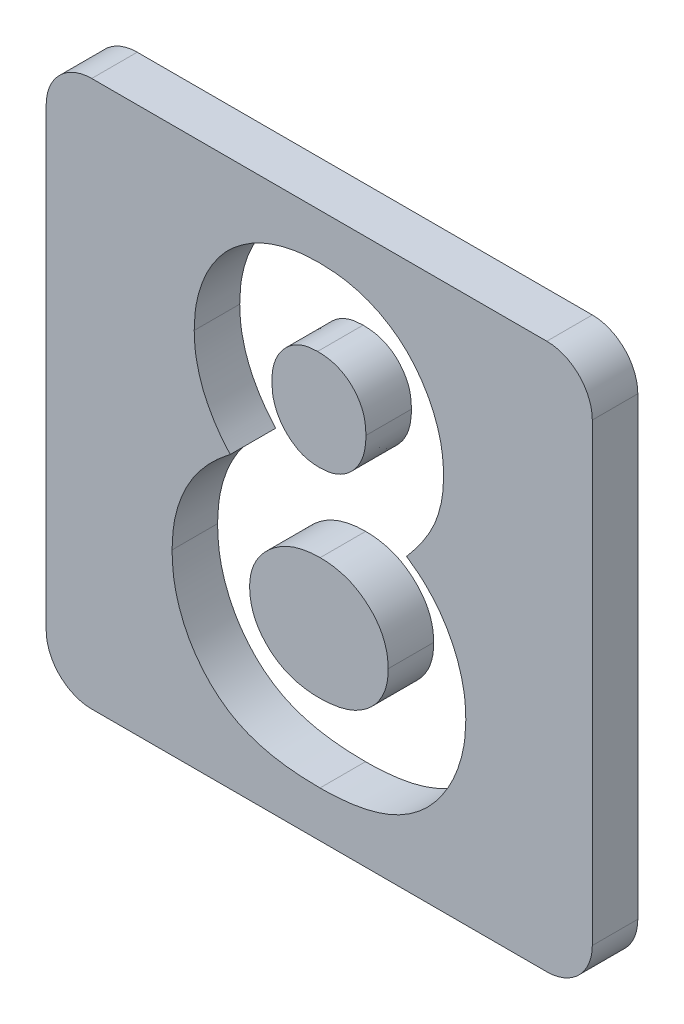
from build123d import *

# Parameters (mm, degrees)
BOSS_EXTRUDE1_DEPTH = 10
CUT_EXTRUDE7_DEPTH  = 10


with BuildPart() as part:
    # Sketch1 → Boss-Extrude1 (new body)
    with BuildSketch(Plane.XY):
        with BuildLine():
            Line((-50, 60), (50, 60))
            ThreePointArc((50, 60), (57.071067812, 57.071067812), (60, 50))
            Line((60, 50), (60, -50))
            ThreePointArc((60, -50), (57.071067812, -57.071067812), (50, -60))
            Line((50, -60), (-50, -60))
            ThreePointArc((-50, -60), (-57.071067812, -57.071067812), (-60, -50))
            Line((-60, -50), (-60, 50))
            ThreePointArc((-60, 50), (-57.071067812, 57.071067812), (-50, 60))
        make_face()
    extrude(amount=BOSS_EXTRUDE1_DEPTH)

    # Sketch2 → Cut-Extrude7 (cut)
    with BuildSketch(Plane.XY.offset(10)):
        with BuildLine():
            add(Edge.make_bspline(
                [(19.188301282, 3.653846154), (20.184495938, 2.942038158), (22.156373381, 1.53307845), (24.760502173, -0.991125553), (27.003564951, -3.806904393), (28.862007101, -6.896986644), (30.350934887, -10.185417286), (31.416781282, -13.637046931), (32.093794674, -17.221431342), (32.167744744, -19.661780222), (32.205128205, -20.895432692)],
                knots=[0, 0, 0, 0, 1.013736912, 2.006600758, 2.994453809, 3.989973287, 4.987781207, 5.978959008, 6.978317308, 8, 8, 8, 8], degree=3))
            add(Edge.make_bspline(
                [(32.205128205, -20.895432692), (32.160027904, -22.231261178), (32.070577244, -24.880705531), (31.279713876, -28.766115268), (30.010014477, -32.498873463), (28.274722464, -36.037779916), (26.098985434, -39.272858958), (23.56296157, -42.136825847), (20.663454018, -44.554883143), (17.963930355, -46.195519421), (15.640356037, -47.285363085), (13.765251942, -47.98284115), (11.785265286, -48.596872991), (9.686267137, -49.087443687), (7.468639207, -49.47041463), (5.135546282, -49.723327923), (2.685452566, -49.907180476), (1.014592239, -49.926163712), (0.157852564, -49.935897436)],
                knots=[0, 0, 0, 0, 1.313679292, 2.605514271, 3.884962679, 5.186178731, 6.472827995, 7.711026938, 8.938935107, 10.174644318, 10.808706728, 11.462743532, 12.142127587, 12.847854939, 13.582806024, 14.355735269, 15.156897313, 16, 16, 16, 16], degree=3))
            add(Edge.make_bspline(
                [(0.157852564, -49.935897436), (-0.75577531, -49.923504468), (-2.539910399, -49.899303445), (-5.144350214, -49.752971256), (-7.601106371, -49.483191446), (-9.915332327, -49.128047212), (-12.084801555, -48.658088465), (-14.109578312, -48.062206506), (-15.994551648, -47.383728602), (-18.301858023, -46.350687769), (-20.938690793, -44.737373284), (-23.788630171, -42.374720743), (-26.290147794, -39.560727744), (-28.464980457, -36.374382651), (-30.179265543, -32.835287864), (-31.454059018, -29.054524044), (-32.209006815, -25.042336581), (-32.299894084, -22.294185431), (-32.346153846, -20.895432692)],
                knots=[0, 0, 0, 0, 0.886964665, 1.7320671, 2.531131818, 3.285397207, 4.004107883, 4.684213108, 5.332925796, 5.947568694, 7.135706876, 8.320776993, 9.52873045, 10.778999824, 12.05415135, 13.333578234, 14.642845846, 16, 16, 16, 16], degree=3))
            add(Edge.make_bspline(
                [(-32.346153846, -20.895432692), (-32.303880176, -19.675251034), (-32.220807296, -17.277446336), (-31.625745014, -13.763904108), (-30.605394029, -10.432650346), (-29.205313672, -7.260494213), (-27.399933808, -4.247082748), (-25.178578493, -1.414588745), (-22.569412256, 1.262540859), (-20.590832741, 2.843522672), (-19.576722756, 3.653846154)],
                knots=[0, 0, 0, 0, 1.01821053, 2.000906977, 2.963938143, 3.919209931, 4.888045165, 5.887808425, 6.917407893, 8, 8, 8, 8], degree=3))
            add(Edge.make_bspline(
                [(-19.576722756, 3.653846154), (-20.205417157, 4.378953164), (-21.44312709, 5.80647049), (-23.044735918, 8.103945857), (-24.394023915, 10.472645366), (-25.539633666, 12.893345782), (-26.3864976, 15.40772552), (-27.02692196, 17.97625338), (-27.389145357, 20.62509678), (-27.445761968, 22.410495947), (-27.474358974, 23.312299679)],
                knots=[0, 0, 0, 0, 1.061529281, 2.089831458, 3.092927091, 4.075998741, 5.048384512, 6.024008542, 7.00192825, 8, 8, 8, 8], degree=3))
            add(Edge.make_bspline(
                [(-27.474358974, 23.312299679), (-27.436443694, 24.533076074), (-27.361638307, 26.94162088), (-26.699091348, 30.463482054), (-25.599102515, 33.809952101), (-24.102661321, 36.971233071), (-22.202413573, 39.878428225), (-19.944507855, 42.485532392), (-17.297202452, 44.697048355), (-14.358943535, 46.594626663), (-11.11500316, 48.10394285), (-7.596159511, 49.160049282), (-3.844903138, 49.828620337), (-1.259649221, 49.899594412), (0.062700321, 49.935897436)],
                knots=[0, 0, 0, 0, 1.022455555, 2.017265428, 2.990720743, 3.968117071, 4.939886797, 5.893155559, 6.847550415, 7.820889576, 8.817530429, 9.83499769, 10.892607882, 12, 12, 12, 12], degree=3))
            add(Edge.make_bspline(
                [(0.062700321, 49.935897436), (1.366004574, 49.899534999), (3.907174979, 49.82863586), (7.592508041, 49.16449477), (11.035308794, 48.08486337), (14.207107804, 46.54367878), (17.114979409, 44.642443103), (19.717291845, 42.353924223), (21.96811219, 39.681885896), (23.884133204, 36.699482457), (25.410907526, 33.48637487), (26.539646383, 30.116764519), (27.192522271, 26.617136868), (27.286208621, 24.241054818), (27.333333333, 23.045873397)],
                knots=[0, 0, 0, 0, 1.094655142, 2.134348324, 3.136019022, 4.118575226, 5.088726318, 6.048298823, 7.020513804, 8.015920439, 9.020015034, 10.003048569, 10.995523219, 12, 12, 12, 12], degree=3))
            add(Edge.make_bspline(
                [(27.333333333, 23.045873397), (27.310632226, 22.201183803), (27.266083001, 20.543543624), (26.936695016, 18.101371831), (26.382046073, 15.758104709), (25.608739865, 13.457115137), (24.533580254, 11.135872394), (23.07863932, 8.749897255), (21.308894722, 6.200051998), (19.91902587, 4.531230372), (19.188301282, 3.653846154)],
                knots=[0, 0, 0, 0, 0.940746401, 1.846144481, 2.739104268, 3.619506754, 4.545839139, 5.581956076, 6.728711598, 8, 8, 8, 8], degree=3))
        make_face()
        with BuildLine():
            add(Edge.make_bspline(
                [(-0.355969551, 32.884615385), (-1.058006441, 32.850770709), (-2.423623299, 32.784935337), (-4.372198645, 32.190698207), (-6.124031459, 31.218781122), (-7.639132699, 29.881231936), (-8.881594696, 28.258316376), (-9.794735999, 26.3924433), (-10.336239585, 24.306639671), (-10.39356827, 22.846120439), (-10.423076923, 22.094350962)],
                knots=[0, 0, 0, 0, 1.018099191, 1.980427864, 2.929421084, 3.909248076, 4.895556904, 5.880788387, 6.909183412, 8, 8, 8, 8], degree=3))
            add(Edge.make_bspline(
                [(-10.423076923, 22.094350962), (-10.386624716, 21.33616122), (-10.315448269, 19.855722672), (-9.755725432, 17.729843978), (-8.801662396, 15.803193319), (-7.491740304, 14.116012106), (-5.899972828, 12.737971286), (-4.117681218, 11.685500408), (-2.12509953, 11.084672073), (-0.740446478, 11.003197614), (-0.032451923, 10.961538462)],
                knots=[0, 0, 0, 0, 1.07118507, 2.091592095, 3.082435519, 4.092579768, 5.090825648, 6.043203473, 6.999459622, 8, 8, 8, 8], degree=3))
            add(Edge.make_bspline(
                [(-0.032451923, 10.961538462), (0.68892764, 10.993817162), (2.09431037, 11.056702125), (4.091867272, 11.673120279), (5.891410758, 12.658955484), (7.432453879, 14.052708358), (8.708910985, 15.740500597), (9.638525218, 17.700821167), (10.173577589, 19.896838181), (10.245008972, 21.43165248), (10.282051282, 22.227564103)],
                knots=[0, 0, 0, 0, 1.008803858, 1.965339183, 2.900766489, 3.864508618, 4.855158575, 5.849593072, 6.884859315, 8, 8, 8, 8], degree=3))
            add(Edge.make_bspline(
                [(10.282051282, 22.227564103), (10.244071952, 22.978836606), (10.170621263, 24.431771227), (9.64395171, 26.517710168), (8.676696729, 28.354461405), (7.405848472, 29.967299003), (5.812545346, 31.267952197), (3.962837117, 32.22446041), (1.870344264, 32.77924443), (0.402205391, 32.848731127), (-0.355969551, 32.884615385)],
                knots=[0, 0, 0, 0, 1.065910571, 2.061433587, 3.023559535, 3.990682701, 4.956464619, 5.918590567, 6.925120432, 8, 8, 8, 8], degree=3))
        make_face(mode=Mode.SUBTRACT)
        with BuildLine():
            add(Edge.make_bspline(
                [(0.195913462, -6.08974359), (-0.337581437, -6.098603068), (-1.389093206, -6.11606499), (-2.934901917, -6.317427104), (-4.418264236, -6.617506465), (-5.837339822, -7.031457481), (-7.184959587, -7.595776876), (-8.472546866, -8.276074338), (-9.695654923, -9.07922681), (-10.836141641, -9.990653065), (-11.866875136, -10.991030217), (-12.795987618, -12.034391147), (-13.555405894, -13.14770957), (-14.187820258, -14.29397844), (-14.695968788, -15.482281302), (-15.031893362, -16.732187052), (-15.248181767, -18.027050466), (-15.279216891, -18.909058919), (-15.294871795, -19.353966346)],
                knots=[0, 0, 0, 0, 1.129580664, 2.226389355, 3.296443603, 4.333934503, 5.352185725, 6.386189251, 7.41493955, 8.447544828, 9.47401038, 10.455044306, 11.4018853, 12.322125673, 13.225630306, 14.132028716, 15.057747923, 16, 16, 16, 16], degree=3))
            add(Edge.make_bspline(
                [(-15.294871795, -19.353966346), (-15.287410391, -19.817960864), (-15.272611619, -20.738236572), (-15.049096904, -22.081453305), (-14.727275196, -23.376893602), (-14.275266318, -24.612431357), (-13.670790334, -25.787347241), (-12.94903503, -26.913063976), (-12.084833098, -27.981687845), (-11.101617086, -28.987489278), (-10.000911129, -29.894901702), (-8.814591332, -30.694347869), (-7.558326263, -31.399180515), (-6.194403741, -31.906828917), (-4.773335261, -32.371473327), (-3.257049947, -32.653361907), (-1.662109023, -32.860783346), (-0.572402607, -32.876535224), (-0.013421474, -32.884615385)],
                knots=[0, 0, 0, 0, 0.973817353, 1.931446211, 2.852767904, 3.776304432, 4.688323523, 5.623710549, 6.581246645, 7.570897993, 8.57436511, 9.572506873, 10.574556662, 11.591826551, 12.624694332, 13.712108235, 14.826391851, 16, 16, 16, 16], degree=3))
            add(Edge.make_bspline(
                [(-0.013421474, -32.884615385), (0.551625294, -32.874373242), (1.652722495, -32.854414549), (3.262305187, -32.6780175), (4.784684748, -32.398126701), (6.218042765, -31.997817659), (7.567799531, -31.485005829), (8.815849199, -30.83229785), (9.990686817, -30.092598077), (11.054558867, -29.228407519), (12.02595247, -28.286620196), (12.862944436, -27.254501376), (13.574629427, -26.165240273), (14.148680931, -25.00706743), (14.611888942, -23.785449885), (14.929620567, -22.488206806), (15.126784469, -21.129916212), (15.144728747, -20.204682424), (15.153846154, -19.734575321)],
                knots=[0, 0, 0, 0, 1.200705402, 2.339794563, 3.437264955, 4.487414319, 5.499029866, 6.500076882, 7.476298407, 8.444948224, 9.407950986, 10.347155707, 11.263432813, 12.167927724, 13.089546445, 14.03463663, 15.00140776, 16, 16, 16, 16], degree=3))
            add(Edge.make_bspline(
                [(15.153846154, -19.734575321), (15.136437283, -19.258322238), (15.102408974, -18.327412501), (14.91621108, -16.952705339), (14.566922827, -15.649461454), (14.109951762, -14.387455358), (13.502075314, -13.192802145), (12.747409865, -12.068023142), (11.888415348, -10.985256241), (10.88444054, -9.992702282), (9.78675022, -9.085155172), (8.618433819, -8.276630316), (7.383089913, -7.591884327), (6.077339418, -7.032138508), (4.696411422, -6.617291072), (3.250842467, -6.317437648), (1.743003817, -6.116019921), (0.716739841, -6.09858949), (0.195913462, -6.08974359)],
                knots=[0, 0, 0, 0, 1.011708178, 1.977538892, 2.938094892, 3.871441737, 4.823268678, 5.775953079, 6.743660653, 7.753304209, 8.767430709, 9.76505158, 10.765940967, 11.761741361, 12.775867861, 13.822051386, 14.89469657, 16, 16, 16, 16], degree=3))
        make_face(mode=Mode.SUBTRACT)
    extrude(amount=-CUT_EXTRUDE7_DEPTH, mode=Mode.SUBTRACT)


with BuildPart() as cut_extrude7_piece_1:
    # of the separate pieces the step leaves, piece 1, a body of its own (cut_extrude7_pieces)
    add(part.part.solids().sort_by_distance((-50, 60, 0))[0])


with BuildPart() as cut_extrude7_piece_2:
    # of the separate pieces the step leaves, piece 2, a body of its own (cut_extrude7_pieces)
    add(part.part.solids().sort_by_distance((0.195913462, -6.08974359, 0))[0])


with BuildPart() as cut_extrude7_piece_3:
    # of the separate pieces the step leaves, piece 3, a body of its own (cut_extrude7_pieces)
    add(part.part.solids().sort_by_distance((-0.355969551, 32.884615385, 0))[0])


solid = Compound([cut_extrude7_piece_1.part, cut_extrude7_piece_2.part, cut_extrude7_piece_3.part])
